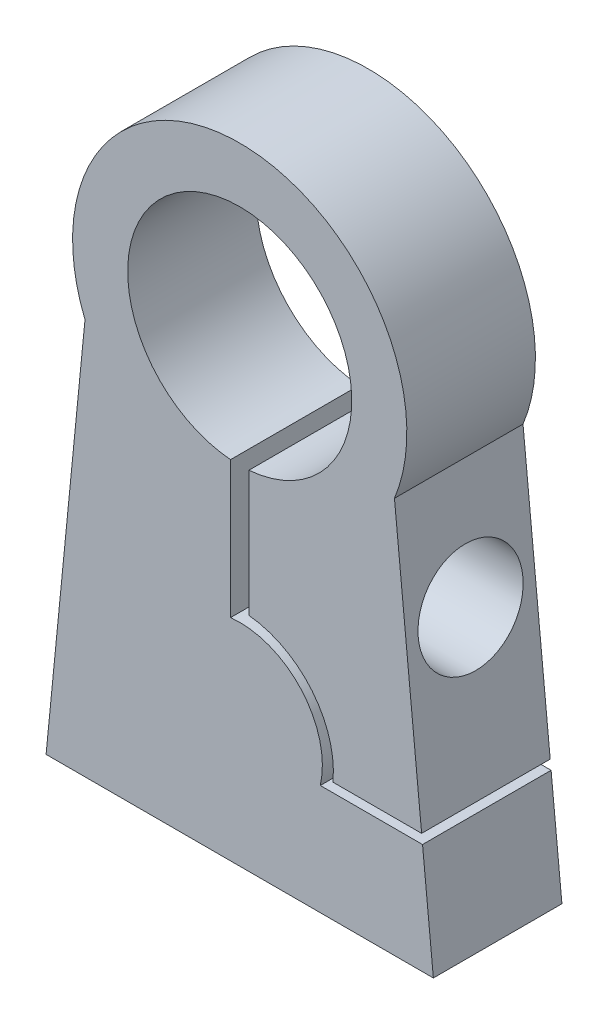
from build123d import *

# Parameters (mm, degrees)
SKETCH1_R                      = 6.1
THICKNESS_DEPTH                = 3.5
BOTNUTCUT_START                = -2
SKETCH2_R                      = 2.85
BOTNUTCUT_DEPTH                = 2.6
SKETCH3_R                      = 1.55
BOTSCREWCUT_DEPTH              = 2
CUT_EXTRUDE1_START             = -7
CUT_EXTRUDE1_DEPTH             = 7
RAILNUTCUT_START               = -2
RAILNUTCUT_DEPTH               = 2.6
SKETCH7_R                      = 1.55
RAILSCREWCUT_DEPTH             = 2.6
RAILSCREWCUT_DIRECTION_2_REACH = 53.909
RAILNUTHEADCUT_REACH           = 56.409
RAILNUTHEADCUT_START           = -2.5
SKETCH8_R                      = 2.85
SKETCH9_W                      = 7
SKETCH9_H                      = 0.5
MOVEMENTCUT_DEPTH              = 7
SKETCH10_R                     = 4.5
BOSS_EXTRUDE1_DEPTH            = 3.5
CUT_EXTRUDE2_START             = -50
SKETCH11_W                     = 40
SKETCH11_H                     = 25
CUT_EXTRUDE2_DEPTH             = 25


with BuildPart() as part:
    # Sketch1 → Thickness (new, symmetric)
    with BuildSketch(Plane.XY):
        with BuildLine():
            Line((-13, -50), (13, -50))
            Line((13, -50), (8.424323952, -3.441041405))
            ThreePointArc((8.424323952, -3.441041405), (0, 9.1), (-8.424323952, -3.441041405))
            Line((-8.424323952, -3.441041405), (-13, -50))
        make_face()
        Circle(SKETCH1_R, mode=Mode.SUBTRACT)
    extrude(amount=THICKNESS_DEPTH, both=True)

    # Sketch2 → BotNutCut (cut)
    with BuildSketch(Plane.XZ.offset(50).offset(BOTNUTCUT_START)):
        with Locations((-7.5, 0)):
            Circle(SKETCH2_R)
        with BuildLine():
            Line((-10.790896534, 2.85), (-10.790896534, 0))
            Line((-10.790896534, 0), (-9.968172361, -1.42500007))
            ThreePointArc((-9.968172361, -1.42500007), (-9.96817242, 1.424999968), (-7.499999995, 2.85))
            Line((-7.499999995, 2.85), (-10.790896534, 2.85))
        make_face()
        with BuildLine():
            Line((-4.209103466, 2.85), (-7.499999995, 2.85))
            ThreePointArc((-7.499999995, 2.85), (-5.484745672, 2.015254324), (-4.65, 0))
            ThreePointArc((-4.65, 0), (-4.747111384, -0.737634237), (-5.031827556, -1.424999925))
            Line((-5.031827556, -1.424999925), (-4.209103466, 0))
            Line((-4.209103466, 0), (-4.209103466, 2.85))
        make_face()
        with BuildLine():
            ThreePointArc((-5.031827556, -1.424999925), (-6.074999963, -2.468172379), (-7.5, -2.85))
            Line((-7.5, -2.85), (-5.854551733, -2.85))
            Line((-5.854551733, -2.85), (-5.031827556, -1.424999925))
        make_face()
        with BuildLine():
            ThreePointArc((-7.5, -2.85), (-8.924999965, -2.468172421), (-9.968172361, -1.42500007))
            Line((-9.968172361, -1.42500007), (-9.145448267, -2.85))
            Line((-9.145448267, -2.85), (-7.5, -2.85))
        make_face()
        with BuildLine():
            ThreePointArc((7.5, -2.85), (6.074999995, -2.468172398), (5.031827593, -1.42499999))
            Line((5.031827593, -1.42499999), (5.854551733, -2.85))
            Line((5.854551733, -2.85), (7.5, -2.85))
        make_face()
        with BuildLine():
            ThreePointArc((9.968172375, -1.425000045), (8.924999978, -2.468172414), (7.5, -2.85))
            Line((7.5, -2.85), (9.145448267, -2.85))
            Line((9.145448267, -2.85), (9.968172375, -1.425000045))
        make_face()
        with BuildLine():
            Line((10.790896534, 2.85), (7.5, 2.85))
            ThreePointArc((7.5, 2.85), (9.515254326, 2.015254326), (10.35, 0))
            ThreePointArc((10.35, 0), (10.252888598, -0.737634304), (9.968172375, -1.425000045))
            Line((9.968172375, -1.425000045), (10.790896534, 0))
            Line((10.790896534, 0), (10.790896534, 2.85))
        make_face()
        with BuildLine():
            Line((4.209103466, 2.85), (4.209103466, 0))
            Line((4.209103466, 0), (5.031827593, -1.42499999))
            ThreePointArc((5.031827593, -1.42499999), (5.031827602, 1.425000005), (7.5, 2.85))
            Line((7.5, 2.85), (4.209103466, 2.85))
        make_face()
        with Locations((7.5, 0)):
            Circle(SKETCH2_R)
    extrude(amount=-BOTNUTCUT_DEPTH, mode=Mode.SUBTRACT)

    # Sketch3 → BotScrewCut (cut)
    with BuildSketch(Plane.XZ.offset(50)):
        with Locations(Location((-7.5, 0, 0), (0, 0, 270))):
            Circle(SKETCH3_R)
        with Locations(Location((7.5, 0, 0), (0, 0, 270))):
            Circle(SKETCH3_R)
    extrude(amount=-BOTSCREWCUT_DEPTH, mode=Mode.SUBTRACT)

    # Sketch5 → Cut-Extrude1 (cut)
    with BuildSketch(Plane.XY.offset(3.5).offset(CUT_EXTRUDE1_START)):
        with BuildLine():
            ThreePointArc((0.5, -6.079473661), (0, -6.1), (-0.5, -6.079473661))
            Line((-0.5, -6.079473661), (-0.5, -12.924568984))
            ThreePointArc((-0.5, -12.924568984), (0, -23.1), (0.5, -12.924568984))
            Line((0.5, -12.924568984), (0.5, -6.079473661))
        make_face()
    extrude(amount=CUT_EXTRUDE1_DEPTH, mode=Mode.SUBTRACT)

    # Sketch6 → RailNutCut (cut)
    with BuildSketch(Plane(origin=(-0.5, 0, 0), x_dir=(0, 0, -1), z_dir=(1, 0, 0)).offset(RAILNUTCUT_START)):
        Polygon((0, -13.290896534), (2.85, -11.645448267), (2.85, -8.354551733), (0, -6.709103466), (-2.85, -6.709103466), (-2.85, -13.290896534), align=None)
    extrude(amount=-RAILNUTCUT_DEPTH, mode=Mode.SUBTRACT)

    # Sketch7 → RailScrewCut (cut)
    with BuildSketch(Plane(origin=(-0.5, 0, 0), x_dir=(0, 0, -1), z_dir=(1, 0, 0))):
        with Locations(Location((0, -10, 0), (0, 0, 270))):
            Circle(SKETCH7_R)
    extrude(amount=-RAILSCREWCUT_DEPTH, mode=Mode.SUBTRACT)

    # RailScrewCut direction 2: up to this plane
    railscrewcut_direction_2_end = Plane(origin=(13, -50, 3.5), z_dir=(-0.9952055153223801, -0.09780583966162733, 0))
    # Sketch7 → RailScrewCut direction 2 (cut, up to the surface)
    with BuildSketch(Plane(origin=(-0.5, 0, 0), x_dir=(0, 0, -1), z_dir=(1, 0, 0)), mode=Mode.PRIVATE) as railscrewcut_direction_2_sk1:
        with Locations(Location((0, -10, 0), (0, 0, 270))):
            Circle(SKETCH7_R)
    railscrewcut_direction_2_tool1 = split(extrude(railscrewcut_direction_2_sk1.sketch, amount=RAILSCREWCUT_DIRECTION_2_REACH, mode=Mode.PRIVATE), bisect_by=railscrewcut_direction_2_end, keep=Keep.BOTH, mode=Mode.PRIVATE)
    add(railscrewcut_direction_2_tool1.solids().sort_by_distance((-0.5, -10, 0))[0], mode=Mode.SUBTRACT)

    # RailNutHeadCut: up to this plane
    railnutheadcut_end = Plane(origin=(13, -50, 3.5), z_dir=(-0.9952055153223801, -0.09780583966162733, 0))
    # Sketch8 → RailNutHeadCut (cut, up to the surface)
    with BuildSketch(Plane.ZY.offset(-0.5).offset(RAILNUTHEADCUT_START), mode=Mode.PRIVATE) as railnutheadcut_sk1:
        with Locations(Location((0, -10, 0), (0, 0, 270))):
            Circle(SKETCH8_R)
    railnutheadcut_tool1 = split(extrude(railnutheadcut_sk1.sketch, amount=-RAILNUTHEADCUT_REACH, mode=Mode.PRIVATE), bisect_by=railnutheadcut_end, keep=Keep.BOTH, mode=Mode.PRIVATE)
    add(railnutheadcut_tool1.solids().sort_by_distance((3, -10, 0))[0], mode=Mode.SUBTRACT)

    # Sketch9 → MovementCut (cut)
    with BuildSketch(Plane.XY.offset(3.5)):
        with Locations((7.5, -18.75)):
            Rectangle(SKETCH9_W, SKETCH9_H)
    extrude(amount=-MOVEMENTCUT_DEPTH, mode=Mode.SUBTRACT)

    # Sketch10 → Boss-Extrude1 (add, symmetric)
    with BuildSketch(Plane.XY):
        with BuildLine():
            Line((-0.5, -13.527864045), (-0.5, -12.924568984))
            ThreePointArc((-0.5, -12.924568984), (-3.780537731, -21.42308844), (5.0009999, -19))
            Line((5.0009999, -19), (4.387482194, -19))
            ThreePointArc((4.387482194, -19), (-3.356217727, -20.997632828), (-0.5, -13.527864045))
        make_face()
        with Locations((0, -18)):
            Circle(SKETCH10_R)
    extrude(amount=BOSS_EXTRUDE1_DEPTH, both=True)

    # Sketch11 → Cut-Extrude2 (cut)
    with BuildSketch(Plane(origin=(0, 0, 0), x_dir=(1, 0, 0), z_dir=(0, 1, 0)).offset(CUT_EXTRUDE2_START)):
        Rectangle(SKETCH11_W, SKETCH11_H)
    extrude(amount=CUT_EXTRUDE2_DEPTH, mode=Mode.SUBTRACT)


solid = part.part
